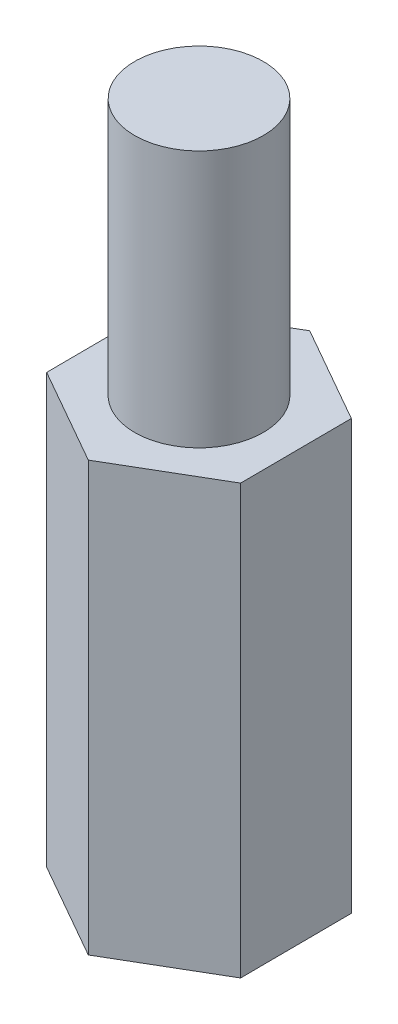
from build123d import *

# Parameters (mm, degrees)
BOSS_EXTRUDE1_DEPTH = 10
SKETCH2_R           = 1.5
BOSS_EXTRUDE2_DEPTH = 6


with BuildPart() as part:
    # Sketch1 → Boss-Extrude1 (new body)
    with BuildSketch(Plane(origin=(0, 0, 0), x_dir=(1, 0, 0), z_dir=(0, 1, 0))):
        Polygon((2.257375378, -1.286178994), (2.242551372, 1.311854926), (-0.014824006, 2.59803392), (-2.257375378, 1.286178994), (-2.242551372, -1.311854926), (0.014824006, -2.59803392), align=None)
    extrude(amount=BOSS_EXTRUDE1_DEPTH)

    # Sketch2 → Boss-Extrude2 (add)
    with BuildSketch(Plane(origin=(0, 10, 0), x_dir=(1, 0, 0), z_dir=(0, 1, 0))):
        with Locations(Location((0, 0, 0), (0, 0, 270))):
            Circle(SKETCH2_R)
    extrude(amount=BOSS_EXTRUDE2_DEPTH)


solid = part.part
